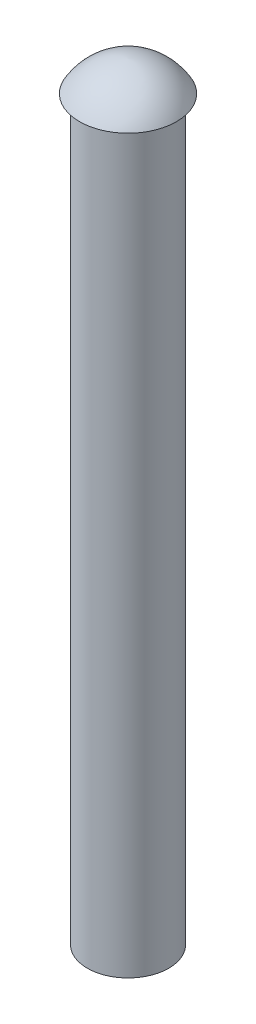
from build123d import *


with BuildPart() as part:
    # Sketch2 → Revolve1 (revolve)
    with BuildSketch(Plane.XY):
        with BuildLine():
            Line((0, -45.121184694), (3.6195, -45.121184694))
            Line((3.6195, -45.121184694), (3.6195, 20.410815306))
            Line((3.6195, 20.410815306), (4.318, 20.410815306))
            ThreePointArc((4.318, 20.410815306), (2.499819305, 22.296264383), (0, 23.078314701))
            Line((0, 23.078314701), (0, -45.121184694))
        make_face()
    revolve(axis=Axis((0, -45.121184694, 0), (0, 1, 0)))


solid = part.part
